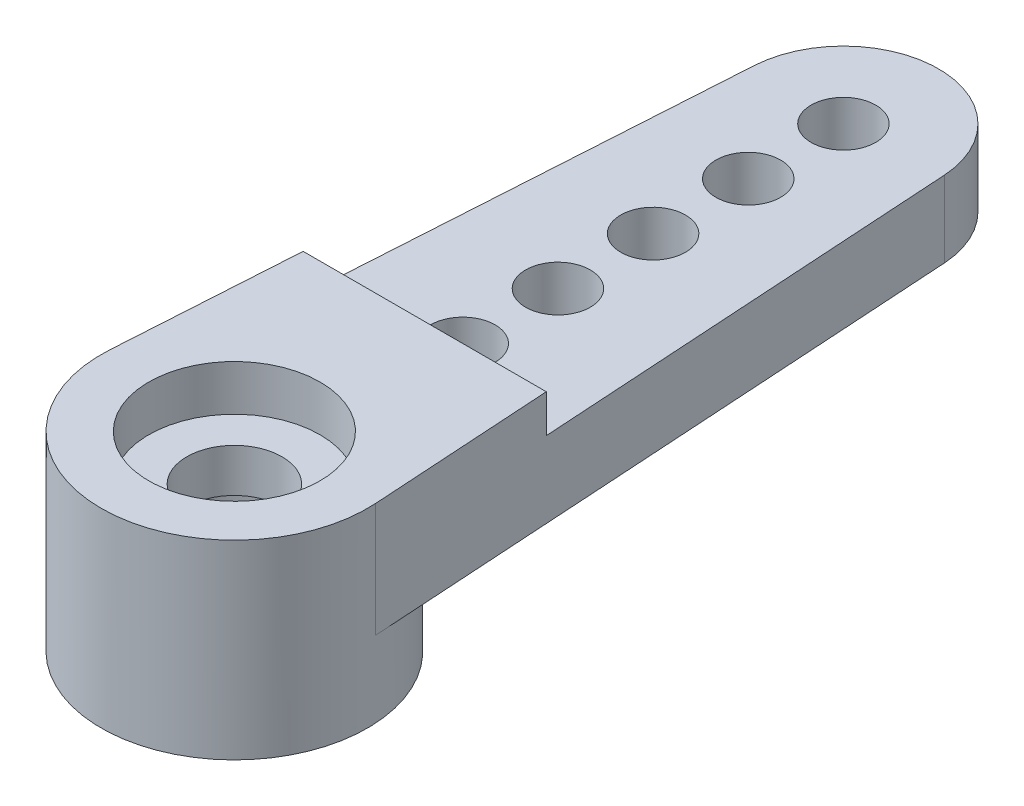
from build123d import *

# Parameters (mm, degrees)
EXTRUDE_START       = -2
EXTRUDE_1_DEPTH     = 2
EXTRUDE_2_DEPTH     = 1
SKETCH_4_R          = 0.85
CUT_EXTRUDE_1_DEPTH = 10


with BuildPart() as part:
    # 草图1 → 旋转1 (revolve)
    with BuildSketch(Plane.XY, mode=Mode.PRIVATE) as revolve_1_sk:
        Polygon((-2.4, 0), (-3.5, 0), (-3.5, 5), (-2.25, 5), (-2.25, 3.8), (-1.25, 3.8), (-1.25, 2.66), (-2.4, 2.66), align=None)
    revolve(revolve_1_sk.sketch.rotate(Axis((0, 0, 0), (0, 1, 0)), 270), axis=Axis((0, 0, 0), (0, 1, 0)))

    # 草图2 → 凸台-拉伸1 (add)
    with BuildSketch(Plane(origin=(0, 2, 0), x_dir=(-1, 0, 0), z_dir=(0, -1, 0)).offset(EXTRUDE_START)):
        with BuildLine():
            Line((-2.49511241, 16.15625), (-3.493157374, 0.21875))
            ThreePointArc((-3.493157374, 0.21875), (0, 3.5), (3.493157374, 0.21875))
            Line((3.493157374, 0.21875), (2.49511241, 16.15625))
            ThreePointArc((2.49511241, 16.15625), (0, 18.5), (-2.49511241, 16.15625))
        make_face()
    extrude(amount=EXTRUDE_1_DEPTH)

    # 草图3 → 凸台-拉伸2 (add)
    with BuildSketch(Plane(origin=(0, 5, 0), x_dir=(1, 0, 0), z_dir=(0, 1, 0))):
        with BuildLine():
            Line((-3.193743885, 5), (3.193743885, 5))
            Line((3.193743885, 5), (3.493157374, 0.21875))
            ThreePointArc((3.493157374, 0.21875), (0, 3.5), (-3.493157374, 0.21875))
            Line((-3.493157374, 0.21875), (-3.193743885, 5))
        make_face()
    extrude(amount=-EXTRUDE_2_DEPTH)

    # 草图4 → 切除-拉伸1 (cut)
    with BuildSketch(Plane.XZ.offset(-2)):
        with Locations(Location((0, -6, 0), (0, 0, 270))):
            Circle(SKETCH_4_R)
        with Locations(Location((0, -16, 0), (0, 0, 270))):
            Circle(SKETCH_4_R)
        with Locations(Location((0, -13.5, 0), (0, 0, 270))):
            Circle(SKETCH_4_R)
        with Locations(Location((0, -8.5, 0), (0, 0, 270))):
            Circle(SKETCH_4_R)
        with Locations(Location((0, -11, 0), (0, 0, 270))):
            Circle(SKETCH_4_R)
    extrude(amount=-CUT_EXTRUDE_1_DEPTH, mode=Mode.SUBTRACT)


solid = part.part
